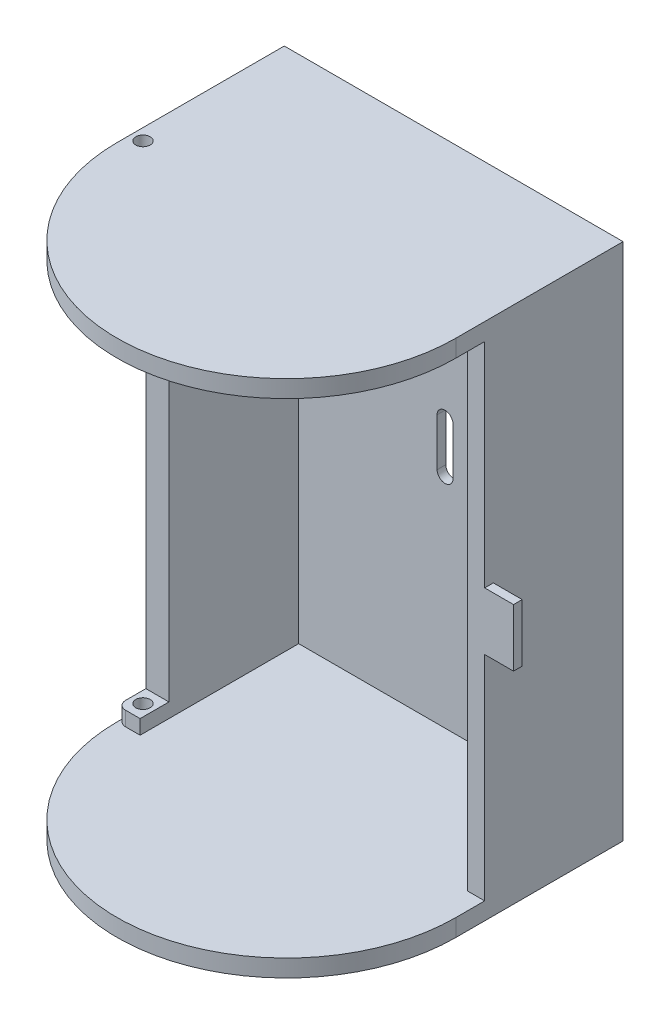
from build123d import *

# Parameters (mm, degrees)
SKETCH_2_W               = 117.5
SKETCH_2_H               = 180
EXTRUDE_2_DEPTH          = 3
EXTRUDE_5_DEPTH          = 6
EXTRUDE_START            = -6
EXTRUDE_6_DEPTH          = 6
EXTRUDE_8_DEPTH          = 8
CUT_EXTRUDE_1_DEPTH      = 188
CUT_EXTRUDE_1_DEPTH_BACK = 20
SKETCH_8_R               = 2.5
FILLET_1_R               = 3
SKETCH_10_W              = 6
SKETCH_10_H              = 168
EXTRUDE_9_DEPTH          = 45
CUT_EXTRUDE_2_DEPTH      = 159.688767718
SKETCH_12_W              = 3
SKETCH_12_H              = 20
EXTRUDE_10_DEPTH         = 10


with BuildPart() as part:
    # 草圖2 → 填料-伸長2 (new body)
    with BuildSketch(Plane.XY):
        Rectangle(SKETCH_2_W, SKETCH_2_H)
    extrude(amount=EXTRUDE_2_DEPTH)

    # 草圖4 → 填料-伸長5 (add)
    with BuildSketch(Plane.XZ.offset(90)):
        with BuildLine():
            Line((-58.75, 3), (-58.75, 58))
            ThreePointArc((-58.75, 58), (0, 116.75), (58.75, 58))
            Line((58.75, 58), (58.75, 3))
            Line((58.75, 3), (-58.75, 3))
        make_face()
    extrude(amount=-EXTRUDE_5_DEPTH)

    # 草圖5 → 填料-伸長6 (add)
    with BuildSketch(Plane(origin=(0, 90, 0), x_dir=(1, 0, 0), z_dir=(0, 1, 0)).offset(EXTRUDE_START)):
        with BuildLine():
            Line((-58.75, -3), (-58.75, -58))
            ThreePointArc((-58.75, -58), (0, -116.75), (58.75, -58))
            Line((58.75, -58), (58.75, -3))
            Line((58.75, -3), (-58.75, -3))
        make_face()
    extrude(amount=EXTRUDE_6_DEPTH)

    # 草圖7 → 填料-伸長8 (add)
    with BuildSketch(Plane.ZY.offset(58.75)):
        Polygon((3, 84), (58, 84), (58, 79), (48, 79), (48, -79), (58, -79), (58, -84), (3, -84), align=None)
    extrude(amount=-EXTRUDE_8_DEPTH)

    # 草圖8 → 除料-伸長1 (cut, two sides: drawn at the far end of the back side and taken through both)
    with BuildSketch(Plane.XZ.offset(-79).offset(-CUT_EXTRUDE_1_DEPTH_BACK)):
        with Locations(Location((-54.75, 53, 0), (0, 0, 90))):
            Circle(SKETCH_8_R)
    extrude(amount=CUT_EXTRUDE_1_DEPTH + CUT_EXTRUDE_1_DEPTH_BACK, mode=Mode.SUBTRACT)

    # 圓角1
    fillet_1_edges = [part.edges().sort_by_distance(p)[0] for p in [
        (-58.75, -81.5, 58),
        (-58.75, 81.5, 58),
    ]]
    fillet(fillet_1_edges, radius=FILLET_1_R)

    # 草圖10 → 填料-伸長9 (add)
    with BuildSketch(Plane.XY.offset(3)):
        with Locations((55.75, 0)):
            Rectangle(SKETCH_10_W, SKETCH_10_H)
    extrude(amount=EXTRUDE_9_DEPTH)

    # 草圖11 → 除料-伸長2 (cut, through all)
    with BuildSketch(Plane(origin=(0, 0, 0), x_dir=(-1, 0, 0), z_dir=(0, 0, -1))):
        with BuildLine():
            Line((2.75, 8.745412879), (2.75, -7.754587121))
            ThreePointArc((2.75, -7.754587121), (0, -10.504587121), (-2.75, -7.754587121))
            Line((-2.75, -7.754587121), (-2.75, 8.745412879))
            ThreePointArc((-2.75, 8.745412879), (0, 11.495412879), (2.75, 8.745412879))
        make_face()
    extrude(amount=-CUT_EXTRUDE_2_DEPTH, mode=Mode.SUBTRACT)

    # 草圖12 → 填料-伸長10 (add)
    with BuildSketch(Plane(origin=(58.75, 0, 0), x_dir=(0, 0, -1), z_dir=(1, 0, 0))):
        with Locations((-46.5, 0)):
            Rectangle(SKETCH_12_W, SKETCH_12_H)
    extrude(amount=EXTRUDE_10_DEPTH)


solid = part.part
